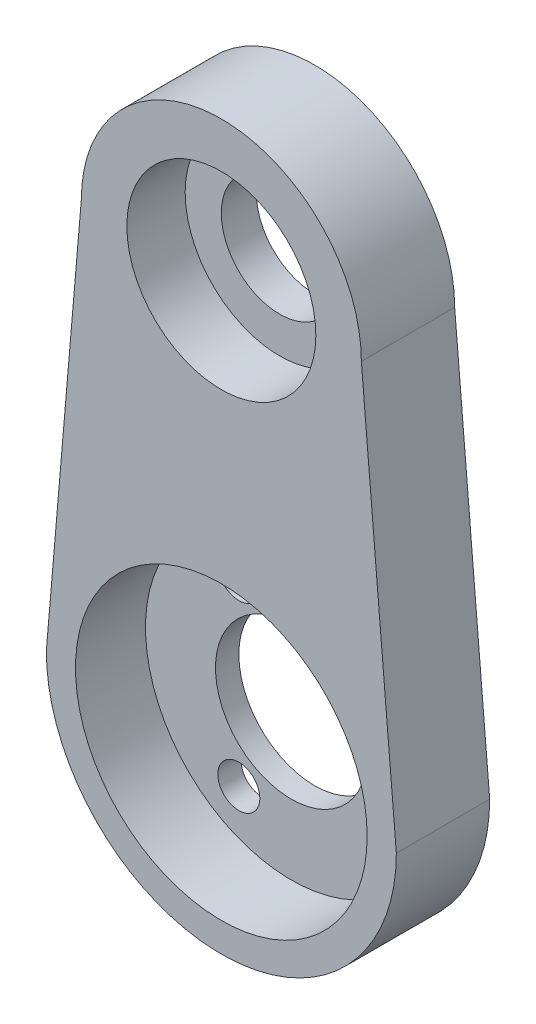
from build123d import *

# Parameters (mm, degrees)
BOSS_EXTRU_1_DEPTH      = 8
ESQUISSE2_R             = 6.5
ENL_V_MAT_EXTRU_1_DEPTH = 10
ESQUISSE3_R             = 1.8
ENL_V_MAT_EXTRU_2_DEPTH = 10
ESQUISSE5_R             = 12.5
ENL_V_MAT_EXTRU_5_DEPTH = 6
ESQUISSE19_R            = 8.1
ENL_V_MAT_EXTRU_6_DEPTH = 10
BOSS_EXTRU_2_START      = -3
ESQUISSE22_R            = 8.1
ESQUISSE22_R_2          = 5
BOSS_EXTRU_2_DEPTH      = 3


with BuildPart() as part:
    # Esquisse1 → Boss.-Extru.1 (new body)
    with BuildSketch(Plane.XY):
        with BuildLine():
            Line((12, 0), (15, -35))
            ThreePointArc((15, -35), (0, -50), (-15, -35))
            Line((-15, -35), (-12, 0))
            ThreePointArc((-12, 0), (0, 12), (12, 0))
        make_face()
    extrude(amount=BOSS_EXTRU_1_DEPTH)

    # Esquisse2 → Enlèv. mat.-Extru.1 (cut)
    with BuildSketch(Plane.XY.offset(8)):
        with Locations((0, -35)):
            Circle(ESQUISSE2_R)
    extrude(amount=-ENL_V_MAT_EXTRU_1_DEPTH, mode=Mode.SUBTRACT)

    # Esquisse3 → Enlèv. mat.-Extru.2 (cut)
    with BuildSketch(Plane.XY.offset(8)):
        with Locations((9, -35)):
            Circle(ESQUISSE3_R)
        with Locations((-4.5, -27.205771366)):
            Circle(ESQUISSE3_R)
        with Locations((-4.5, -42.794228634)):
            Circle(ESQUISSE3_R)
    extrude(amount=-ENL_V_MAT_EXTRU_2_DEPTH, mode=Mode.SUBTRACT)

    # Esquisse5 → Enlèv. mat.-Extru.5 (cut)
    with BuildSketch(Plane.XY.offset(8)):
        with Locations((0, -35)):
            Circle(ESQUISSE5_R)
    extrude(amount=-ENL_V_MAT_EXTRU_5_DEPTH, mode=Mode.SUBTRACT)

    # Esquisse19 → Enlèv. mat.-Extru.6 (cut)
    with BuildSketch(Plane.XY.offset(8)):
        Circle(ESQUISSE19_R)
    extrude(amount=-ENL_V_MAT_EXTRU_6_DEPTH, mode=Mode.SUBTRACT)

    # Esquisse22 → Boss.-Extru.2 (add)
    with BuildSketch(Plane(origin=(0, 0, 0), x_dir=(-1, 0, 0), z_dir=(0, 0, -1)).offset(BOSS_EXTRU_2_START)):
        with Locations(Location((0, 0, 0), (0, 0, 180))):
            Circle(ESQUISSE22_R)
        Circle(ESQUISSE22_R_2, mode=Mode.SUBTRACT)
    extrude(amount=BOSS_EXTRU_2_DEPTH)


solid = part.part
